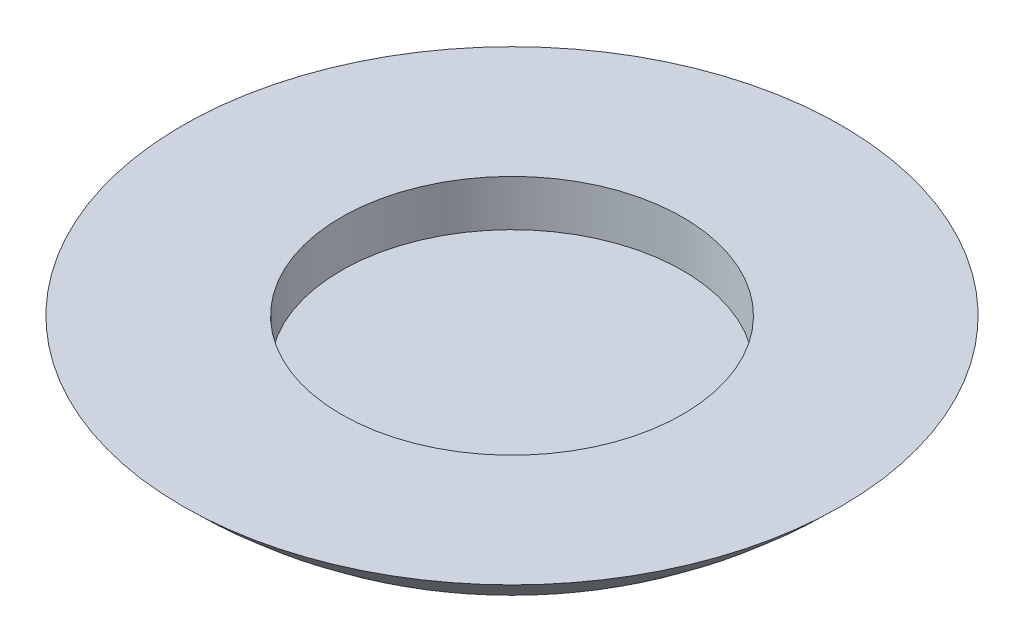
from build123d import *

# Parameters (mm, degrees)
SKETCH_2_R          = 3700
CUT_EXTRUDE_2_DEPTH = 1000


with BuildPart() as part:
    # ｽｹｯﾁ1 → 回転1 (revolve)
    with BuildSketch(Plane.XY):
        with BuildLine():
            Line((0, -10000), (0, -7000))
            Line((0, -7000), (7141.428428543, -7000))
            ThreePointArc((7141.428428543, -7000), (3872.983346207, -9219.544457293), (0, -10000))
        make_face()
    revolve(axis=Axis((0, 10000, 0), (0, -1, 0)))

    # ｽｹｯﾁ2 → ｶｯﾄ - 押し出し2 (cut)
    with BuildSketch(Plane(origin=(0, -7000, 0), x_dir=(1, 0, 0), z_dir=(0, 1, 0))):
        Circle(SKETCH_2_R)
    extrude(amount=-CUT_EXTRUDE_2_DEPTH, mode=Mode.SUBTRACT)


solid = part.part
